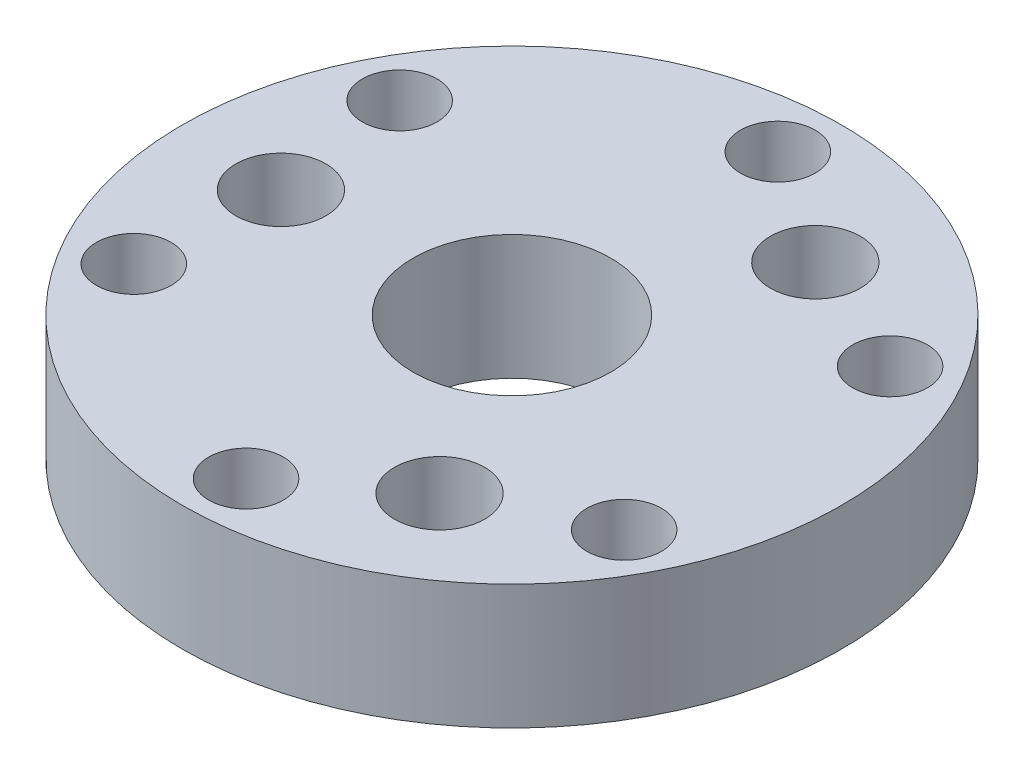
from build123d import *

# Parameters (mm, degrees)
DISCO_START    = 3.175
CROQUIS5_R     = 15
DISCO_DEPTH    = 5.67
BARRENOS_START = 3.175
CROQUIS6_R     = 1.7
CROQUIS6_R_2   = 2.05
CROQUIS6_R_3   = 4.5
BARRENOS_DEPTH = 5.67


with BuildPart() as part:
    # Croquis5 → Disco (new body)
    with BuildSketch(Plane(origin=(0, 0, 0), x_dir=(1, 0, 0), z_dir=(0, 1, 0)).offset(DISCO_START)):
        with Locations(Location((152.4, -171.45, 0), (0, 0, 270))):
            Circle(CROQUIS5_R)
    extrude(amount=DISCO_DEPTH)

    # Croquis6 → Barrenos (cut)
    with BuildSketch(Plane(origin=(0, 0, 0), x_dir=(1, 0, 0), z_dir=(0, 1, 0)).offset(BARRENOS_START)):
        with Locations(Location((163.416293151, -177.356884561, 0), (0, 0, 270))):
            Circle(CROQUIS6_R)
        with Locations(Location((152.792634488, -183.943832005, 0), (0, 0, 270))):
            Circle(CROQUIS6_R)
        with Locations(Location((141.776341338, -178.036947444, 0), (0, 0, 270))):
            Circle(CROQUIS6_R)
        with Locations(Location((141.383706849, -165.543115439, 0), (0, 0, 270))):
            Circle(CROQUIS6_R)
        with Locations(Location((152.007365512, -158.956167995, 0), (0, 0, 270))):
            Circle(CROQUIS6_R)
        with Locations(Location((163.023658662, -164.863052556, 0), (0, 0, 270))):
            Circle(CROQUIS6_R)
        with Locations(Location((157.774949114, -180.118905468, 0), (0, 0, 270))):
            Circle(CROQUIS6_R_2)
        with Locations(Location((142.205033084, -171.770389743, 0), (0, 0, 270))):
            Circle(CROQUIS6_R_2)
        with Locations(Location((157.220017802, -162.460704789, 0), (0, 0, 270))):
            Circle(CROQUIS6_R_2)
        with Locations(Location((152.4, -171.45, 0), (0, 0, 270))):
            Circle(CROQUIS6_R_3)
    extrude(amount=BARRENOS_DEPTH, mode=Mode.SUBTRACT)


solid = part.part
